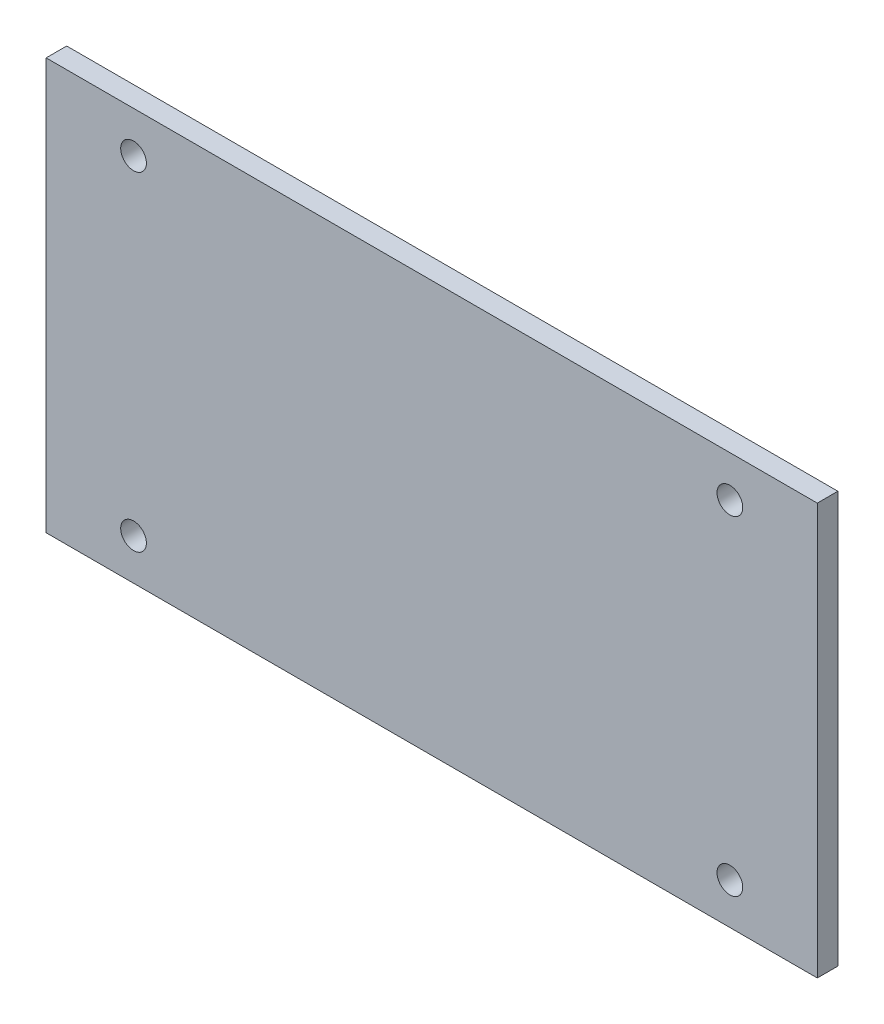
from build123d import *

# Parameters (mm, degrees)
ESBO_O1_W                = 150
ESBO_O1_H                = 80
ESBO_O1_R                = 2.5
RESSALTO_EXTRUS_O2_DEPTH = 4


with BuildPart() as part:
    # Esboço1 → Ressalto-extrusão2 (new body)
    with BuildSketch(Plane.XY):
        with Locations((20.344262425, 7.949915335)):
            Rectangle(ESBO_O1_W, ESBO_O1_H)
        with Locations((-37.655737575, 39.949915335)):
            Circle(ESBO_O1_R, mode=Mode.SUBTRACT)
        with Locations((-37.655737575, -24.050084665)):
            Circle(ESBO_O1_R, mode=Mode.SUBTRACT)
        with Locations((78.344262425, 39.949915335)):
            Circle(ESBO_O1_R, mode=Mode.SUBTRACT)
        with Locations((78.344262425, -24.050084665)):
            Circle(ESBO_O1_R, mode=Mode.SUBTRACT)
    extrude(amount=RESSALTO_EXTRUS_O2_DEPTH)


solid = part.part
